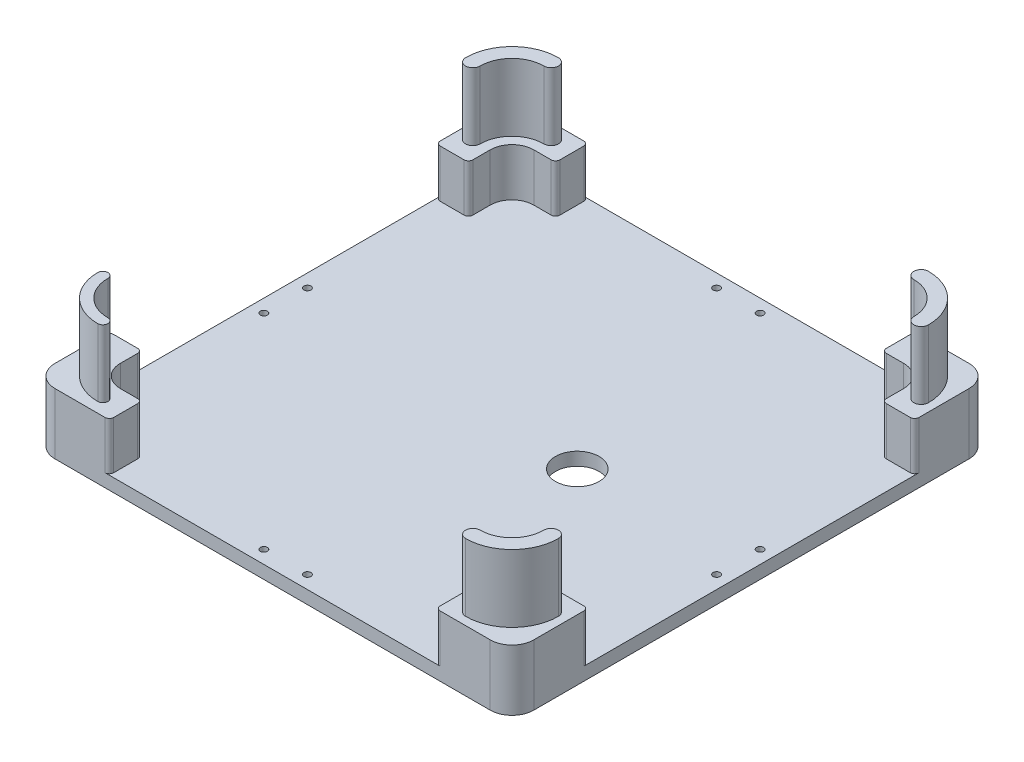
from build123d import *

# Parameters (mm, degrees)
SKETCH2_W           = 220
SKETCH2_H           = 220
BOSS_EXTRUDE1_DEPTH = 6
FILLET1_R           = 10
BOSS_EXTRUDE3_DEPTH = 53
BOSS_EXTRUDE4_START = 22
BOSS_EXTRUDE4_DEPTH = 22
FILLET2_R           = 2
CUT_EXTRUDE2_REACH  = 168.376
SKETCH7_R           = 10
CUT_EXTRUDE3_REACH  = 168.376
SKETCH8_R           = 1.6


with BuildPart() as part:
    # Sketch2 → Boss-Extrude1 (new body)
    with BuildSketch(Plane(origin=(0, 0, 0), x_dir=(1, 0, 0), z_dir=(0, 1, 0))):
        Rectangle(SKETCH2_W, SKETCH2_H)
    extrude(amount=BOSS_EXTRUDE1_DEPTH)

    # Fillet1
    fillet1_edges = [part.edges().sort_by_distance(p)[0] for p in [
        (110, 3, 110),
        (-110, 3, 110),
        (-110, 3, -110),
        (110, 3, -110),
    ]]
    fillet(fillet1_edges, radius=FILLET1_R)

    # Sketch4 → Boss-Extrude3 (add)
    with BuildSketch(Plane(origin=(0, 6, 0), x_dir=(1, 0, 0), z_dir=(0, 1, 0))):
        with BuildLine():
            ThreePointArc((-105.325, -85), (-99.371945328, -99.371945328), (-85, -105.325))
            ThreePointArc((-85, -105.325), (-82.675, -103), (-85, -100.675))
            ThreePointArc((-85, -100.675), (-96.083898795, -96.083898795), (-100.675, -85))
            ThreePointArc((-100.675, -85), (-103, -82.675), (-105.325, -85))
        make_face()
        with BuildLine():
            ThreePointArc((106.325, -85), (100.079052109, -100.079052109), (85, -106.325))
            ThreePointArc((85, -106.325), (81.675, -103), (85, -99.675))
            ThreePointArc((85, -99.675), (95.376792014, -95.376792014), (99.675, -85))
            ThreePointArc((99.675, -85), (103, -81.675), (106.325, -85))
        make_face()
        with BuildLine():
            ThreePointArc((106.325, 85), (100.079052109, 100.079052109), (85, 106.325))
            ThreePointArc((85, 106.325), (81.675, 103), (85, 99.675))
            ThreePointArc((85, 99.675), (95.376792014, 95.376792014), (99.675, 85))
            ThreePointArc((99.675, 85), (103, 81.675), (106.325, 85))
        make_face()
        with BuildLine():
            ThreePointArc((-106.325, 85), (-100.079052109, 100.079052109), (-85, 106.325))
            ThreePointArc((-85, 106.325), (-81.675, 103), (-85, 99.675))
            ThreePointArc((-85, 99.675), (-95.376792014, 95.376792014), (-99.675, 85))
            ThreePointArc((-99.675, 85), (-103, 81.675), (-106.325, 85))
        make_face()
    extrude(amount=BOSS_EXTRUDE3_DEPTH)

    # Sketch3 → Boss-Extrude4 (add)
    with BuildSketch(Plane(origin=(0, 6, 0), x_dir=(1, 0, 0), z_dir=(0, 1, 0)).offset(BOSS_EXTRUDE4_START)):
        with BuildLine():
            Line((75, 95), (75, 110))
            Line((75, 110), (100, 110))
            ThreePointArc((100, 110), (107.071067812, 107.071067812), (110, 100))
            Line((110, 100), (110, 75))
            Line((110, 75), (95, 75))
            Line((95, 75), (95, 85))
            ThreePointArc((95, 85), (92.071067812, 92.071067812), (85, 95))
            Line((85, 95), (75, 95))
        make_face()
        with BuildLine():
            Line((-75, 110), (-100, 110))
            ThreePointArc((-100, 110), (-107.071067812, 107.071067812), (-110, 100))
            Line((-110, 100), (-110, 75))
            Line((-110, 75), (-95, 75))
            Line((-95, 75), (-95, 85))
            ThreePointArc((-95, 85), (-92.071067812, 92.071067812), (-85, 95))
            Line((-85, 95), (-75, 95))
            Line((-75, 95), (-75, 110))
        make_face()
        with BuildLine():
            Line((-75, -95), (-75, -110))
            Line((-75, -110), (-100, -110))
            ThreePointArc((-100, -110), (-107.071067812, -107.071067812), (-110, -100))
            Line((-110, -100), (-110, -75))
            Line((-110, -75), (-95, -75))
            Line((-95, -75), (-95, -85))
            ThreePointArc((-95, -85), (-92.071067812, -92.071067812), (-85, -95))
            Line((-85, -95), (-75, -95))
        make_face()
        with BuildLine():
            Line((75, -110), (100, -110))
            ThreePointArc((100, -110), (107.071067812, -107.071067812), (110, -100))
            Line((110, -100), (110, -75))
            Line((110, -75), (95, -75))
            Line((95, -75), (95, -85))
            ThreePointArc((95, -85), (92.071067812, -92.071067812), (85, -95))
            Line((85, -95), (75, -95))
            Line((75, -95), (75, -110))
        make_face()
    extrude(amount=-BOSS_EXTRUDE4_DEPTH)

    # Fillet2
    fillet2_edges = [part.edges().sort_by_distance(p)[0] for p in [
        (75, 17, -95),
        (95, 17, -75),
        (110, 17, -75),
        (75, 17, -110),
        (-110, 17, -75),
        (-95, 17, -75),
        (-75, 17, -95),
        (-75, 17, -110),
        (-95, 17, 75),
        (-110, 17, 75),
        (-75, 17, 110),
        (-75, 17, 95),
        (110, 17, 75),
        (95, 17, 75),
        (75, 17, 95),
        (75, 17, 110),
    ]]
    fillet(fillet2_edges, radius=FILLET2_R)

    # Sketch7 → Cut-Extrude2 (cut, up to next)
    with BuildSketch(Plane.XZ, mode=Mode.PRIVATE) as cut_extrude2_sk1:
        with Locations(Location((30, 0, 0), (0, 0, 270))):
            Circle(SKETCH7_R)
    cut_extrude2_tool1 = extrude(cut_extrude2_sk1.sketch, amount=-CUT_EXTRUDE2_REACH, mode=Mode.PRIVATE) & part.part
    add(cut_extrude2_tool1.solids().sort_by_distance((30, 0, 0))[0], mode=Mode.SUBTRACT)

    # Sketch8 → Cut-Extrude3 (cut, up to next)
    with BuildSketch(Plane.XZ, mode=Mode.PRIVATE) as cut_extrude3_sk1:
        with Locations(Location((-104, 10, 0), (0, 0, 270))):
            Circle(SKETCH8_R)
    cut_extrude3_tool1 = extrude(cut_extrude3_sk1.sketch, amount=-CUT_EXTRUDE3_REACH, mode=Mode.PRIVATE) & part.part
    # Sketch8 → Cut-Extrude3 (cut, up to next)
    with BuildSketch(Plane.XZ, mode=Mode.PRIVATE) as cut_extrude3_sk2:
        with Locations(Location((-104, -10, 0), (0, 0, 270))):
            Circle(SKETCH8_R)
    cut_extrude3_tool2 = extrude(cut_extrude3_sk2.sketch, amount=-CUT_EXTRUDE3_REACH, mode=Mode.PRIVATE) & part.part
    # Sketch8 → Cut-Extrude3 (cut, up to next)
    with BuildSketch(Plane.XZ, mode=Mode.PRIVATE) as cut_extrude3_sk3:
        with Locations(Location((-10, 104, 0), (0, 0, 270))):
            Circle(SKETCH8_R)
    cut_extrude3_tool3 = extrude(cut_extrude3_sk3.sketch, amount=-CUT_EXTRUDE3_REACH, mode=Mode.PRIVATE) & part.part
    # Sketch8 → Cut-Extrude3 (cut, up to next)
    with BuildSketch(Plane.XZ, mode=Mode.PRIVATE) as cut_extrude3_sk4:
        with Locations(Location((10, 104, 0), (0, 0, 270))):
            Circle(SKETCH8_R)
    cut_extrude3_tool4 = extrude(cut_extrude3_sk4.sketch, amount=-CUT_EXTRUDE3_REACH, mode=Mode.PRIVATE) & part.part
    # Sketch8 → Cut-Extrude3 (cut, up to next)
    with BuildSketch(Plane.XZ, mode=Mode.PRIVATE) as cut_extrude3_sk5:
        with Locations(Location((104, 10, 0), (0, 0, 270))):
            Circle(SKETCH8_R)
    cut_extrude3_tool5 = extrude(cut_extrude3_sk5.sketch, amount=-CUT_EXTRUDE3_REACH, mode=Mode.PRIVATE) & part.part
    # Sketch8 → Cut-Extrude3 (cut, up to next)
    with BuildSketch(Plane.XZ, mode=Mode.PRIVATE) as cut_extrude3_sk6:
        with Locations(Location((104, -10, 0), (0, 0, 270))):
            Circle(SKETCH8_R)
    cut_extrude3_tool6 = extrude(cut_extrude3_sk6.sketch, amount=-CUT_EXTRUDE3_REACH, mode=Mode.PRIVATE) & part.part
    # Sketch8 → Cut-Extrude3 (cut, up to next)
    with BuildSketch(Plane.XZ, mode=Mode.PRIVATE) as cut_extrude3_sk7:
        with Locations(Location((10, -104, 0), (0, 0, 270))):
            Circle(SKETCH8_R)
    cut_extrude3_tool7 = extrude(cut_extrude3_sk7.sketch, amount=-CUT_EXTRUDE3_REACH, mode=Mode.PRIVATE) & part.part
    # Sketch8 → Cut-Extrude3 (cut, up to next)
    with BuildSketch(Plane.XZ, mode=Mode.PRIVATE) as cut_extrude3_sk8:
        with Locations(Location((-10, -104, 0), (0, 0, 270))):
            Circle(SKETCH8_R)
    cut_extrude3_tool8 = extrude(cut_extrude3_sk8.sketch, amount=-CUT_EXTRUDE3_REACH, mode=Mode.PRIVATE) & part.part
    add(cut_extrude3_tool1.solids().sort_by_distance((-104, 0, 10))[0], mode=Mode.SUBTRACT)
    add(cut_extrude3_tool2.solids().sort_by_distance((-104, 0, -10))[0], mode=Mode.SUBTRACT)
    add(cut_extrude3_tool3.solids().sort_by_distance((-10, 0, 104))[0], mode=Mode.SUBTRACT)
    add(cut_extrude3_tool4.solids().sort_by_distance((10, 0, 104))[0], mode=Mode.SUBTRACT)
    add(cut_extrude3_tool5.solids().sort_by_distance((104, 0, 10))[0], mode=Mode.SUBTRACT)
    add(cut_extrude3_tool6.solids().sort_by_distance((104, 0, -10))[0], mode=Mode.SUBTRACT)
    add(cut_extrude3_tool7.solids().sort_by_distance((10, 0, -104))[0], mode=Mode.SUBTRACT)
    add(cut_extrude3_tool8.solids().sort_by_distance((-10, 0, -104))[0], mode=Mode.SUBTRACT)


solid = part.part
